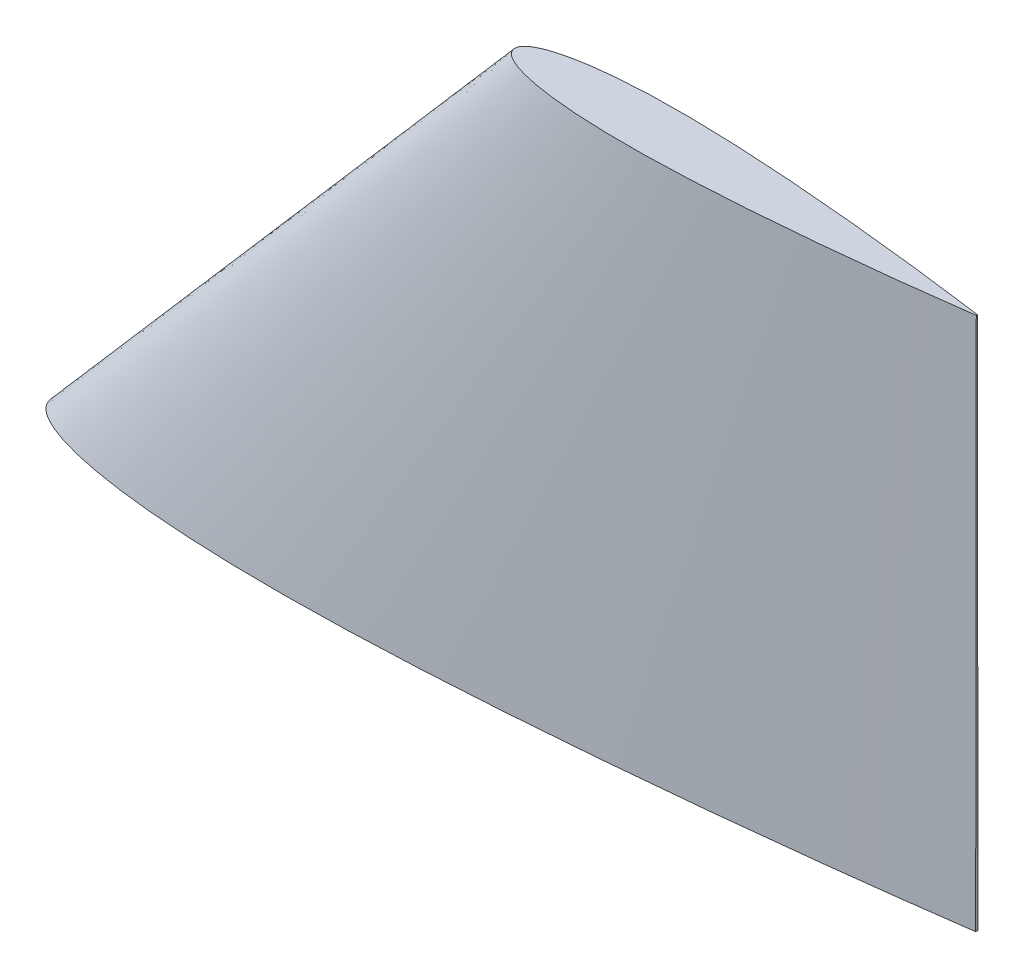
from build123d import *


with BuildPart() as part:
    # Sketch5 → Loft11 section 0
    with BuildSketch(Plane(origin=(0, 43.994090512, 0), x_dir=(1, 0, 0), z_dir=(0, 1, 0))):
        with BuildLine():
            Line((76.2, 0.048006), (76.2, -0.048006))
            add(Edge.make_bspline(
                [(76.2, -0.048006), (76.192583251, -0.049047765), (76.162942912, -0.053211081), (76.044647253, -0.069755857), (75.867562125, -0.094486743), (75.632052521, -0.126965392), (75.390396557, -0.160190201), (75.106127116, -0.198904989), (74.779917937, -0.242859006), (74.412541545, -0.291864294), (74.004851816, -0.345569023), (73.55779868, -0.403720926), (73.072416984, -0.465853222), (72.352060102, -0.55677244), (71.584541596, -0.651127112), (70.771637318, -0.748448048), (70.113353772, -0.825737809), (69.424771293, -0.904853153), (68.707537282, -0.985592031), (67.963304352, -1.067375261), (67.193834288, -1.14998319), (66.400894079, -1.232825488), (65.586352847, -1.315748636), (64.752102975, -1.398113207), (63.90010602, -1.479660513), (63.032340473, -1.559824173), (62.150830619, -1.638342101), (61.257640656, -1.714565201), (60.354852072, -1.788152536), (59.444584786, -1.858634165), (58.528953151, -1.925444296), (57.610108942, -1.988163902), (56.690197069, -2.046291991), (55.467880801, -2.116763144), (54.251069434, -2.176215597), (52.748712156, -2.234066929), (51.565971548, -2.266645454), (50.400091132, -2.283584551), (49.548035029, -2.288048273), (48.713726655, -2.284102235), (47.899118606, -2.271569022), (47.10611977, -2.250069868), (46.336564553, -2.21969991), (45.59224861, -2.180240934), (44.874904805, -2.131803537), (44.186222319, -2.074397819), (43.527802298, -2.008128116), (42.901174603, -1.933245819), (42.307783855, -1.850055304), (41.749027942, -1.758711647), (41.226187427, -1.659671366), (40.740465618, -1.55330687), (40.292997688, -1.439978722), (39.8847724, -1.320194614), (39.516689892, -1.194352348), (39.189535118, -1.062886557), (38.903955697, -0.926176493), (38.660495695, -0.784506781), (38.45943861, -0.638117579), (38.30117294, -0.486768084), (38.186080347, -0.330029549), (38.115712554, -0.167135854), (38.092341043, 0), (38.115712554, 0.167135854), (38.186080347, 0.330029549), (38.30117294, 0.486768084), (38.45943861, 0.638117579), (38.660495695, 0.784506781), (38.903955697, 0.926176493), (39.189535118, 1.062886557), (39.516689892, 1.194352348), (39.8847724, 1.320194614), (40.292997688, 1.439978722), (40.740465618, 1.55330687), (41.226187427, 1.659671366), (41.749027942, 1.758711647), (42.307783855, 1.850055304), (42.901174603, 1.933245819), (43.527802298, 2.008128116), (44.186222319, 2.074397819), (44.874904805, 2.131803537), (45.59224861, 2.180240934), (46.336564553, 2.21969991), (47.10611977, 2.250069868), (47.899118606, 2.271569022), (48.713726655, 2.284102235), (49.548035029, 2.288048273), (50.400091132, 2.283584551), (51.565971548, 2.266645454), (53.052575769, 2.225697023), (54.554732583, 2.162253193), (55.771346838, 2.09926718), (56.690197069, 2.046291991), (57.610108942, 1.988163902), (58.528953151, 1.925444296), (59.444584786, 1.858634165), (60.354852072, 1.788152536), (61.257640656, 1.714565201), (62.150830619, 1.638342101), (63.032340473, 1.559824173), (63.90010602, 1.479660513), (64.752102975, 1.398113207), (65.586352847, 1.315748636), (66.400894079, 1.232825488), (67.193834288, 1.14998319), (67.963304352, 1.067375261), (68.707537282, 0.985592031), (69.424771293, 0.904853153), (70.113353772, 0.825737809), (70.771637318, 0.748448048), (71.584541596, 0.651127112), (72.352060102, 0.55677244), (73.072416984, 0.465853222), (73.55779868, 0.403720926), (74.004851816, 0.345569023), (74.412541545, 0.291864294), (74.779917937, 0.242859006), (75.106127116, 0.198904989), (75.390396557, 0.160190201), (75.632052521, 0.126965392), (75.867562125, 0.094486743), (76.044647253, 0.069755857), (76.162942912, 0.053211081), (76.192583251, 0.049047765), (76.2, 0.048006)],
                knots=[0, 0, 0, 0, 0.000289201, 0.001155766, 0.004612322, 0.007193518, 0.010335793, 0.014031397, 0.018271612, 0.023045847, 0.028342901, 0.03415012, 0.04045376, 0.04723833, 0.062186613, 0.070313724, 0.078851908, 0.087780126, 0.097077521, 0.106722049, 0.116690868, 0.126960505, 0.137507218, 0.148306055, 0.159330765, 0.17055649, 0.181956531, 0.193504043, 0.205171367, 0.2169323, 0.228758169, 0.2406214, 0.252494936, 0.264350287, 0.287897994, 0.299535854, 0.322404759, 0.333584032, 0.344559266, 0.35530596, 0.365799778, 0.37601757, 0.3859373, 0.395537659, 0.404797976, 0.413698812, 0.422221441, 0.430349273, 0.438066019, 0.445356904, 0.452209372, 0.458611567, 0.464554044, 0.47002985, 0.475034902, 0.479569141, 0.483636857, 0.487250263, 0.490431338, 0.493218828, 0.495674086, 0.497891368, 0.5, 0.502108632, 0.504325914, 0.506781172, 0.509568662, 0.512749737, 0.516363143, 0.520430859, 0.524965098, 0.52997015, 0.535445956, 0.541388433, 0.547790628, 0.554643096, 0.561933981, 0.569650727, 0.577778559, 0.586301188, 0.595202024, 0.604462341, 0.6140627, 0.62398243, 0.634200222, 0.64469404, 0.655440734, 0.666415968, 0.677595241, 0.700464146, 0.723839427, 0.735649713, 0.747505064, 0.7593786, 0.771241831, 0.7830677, 0.794828633, 0.806495957, 0.818043469, 0.82944351, 0.840669235, 0.851693945, 0.862492782, 0.873039495, 0.883309132, 0.893277951, 0.902922479, 0.912219874, 0.921148092, 0.929686276, 0.937813387, 0.95276167, 0.95954624, 0.96584988, 0.971657099, 0.976954153, 0.981728388, 0.985968603, 0.989664207, 0.992806482, 0.995387678, 0.998844234, 0.999710799, 1, 1, 1, 1], degree=3))
        make_face()
    # Sketch3 → Loft11 section 1
    with BuildSketch(Plane(origin=(0, 0, 0), x_dir=(1, 0, 0), z_dir=(0, 1, 0))):
        with BuildLine():
            Line((76.2, 0.096012), (76.2, -0.096012))
            add(Edge.make_bspline(
                [(76.2, -0.096012), (76.185166502, -0.09809553), (76.125885823, -0.106422162), (75.889294507, -0.139511713), (75.53512425, -0.188973486), (75.064105041, -0.253930784), (74.580793115, -0.320380401), (74.012254232, -0.397809978), (73.359835874, -0.485718012), (72.62508309, -0.583728588), (71.809703632, -0.691138045), (70.915597359, -0.807441851), (69.944833968, -0.931706445), (68.504120203, -1.113544881), (66.969083191, -1.302254225), (65.343274636, -1.496896097), (64.026707544, -1.651475618), (62.649542587, -1.809706305), (61.215074564, -1.971184062), (59.726608705, -2.134750522), (58.187668577, -2.299966381), (56.601788159, -2.465650976), (54.972705694, -2.631497273), (53.30420595, -2.796226414), (51.60021204, -2.959321026), (49.864680946, -3.119648346), (48.101661238, -3.276684202), (46.315281313, -3.429130403), (44.509704144, -3.576305072), (42.689169571, -3.71726833), (40.857906302, -3.850888591), (39.020217884, -3.976327805), (37.180394137, -4.092583982), (34.735761601, -4.233526287), (32.302138868, -4.352431193), (29.297424312, -4.468133858), (26.931943095, -4.533290908), (24.600182263, -4.567169102), (22.896070057, -4.576096546), (21.22745331, -4.56820447), (19.598237213, -4.543138044), (18.01223954, -4.500139735), (16.473129105, -4.43939982), (14.98449722, -4.360481867), (13.549809609, -4.263607073), (12.172444638, -4.148795638), (10.855604596, -4.016256231), (9.602349205, -3.866491638), (8.41556771, -3.700110609), (7.298055884, -3.517423293), (6.252374854, -3.319342733), (5.280931237, -3.10661374), (4.385995376, -2.879957444), (3.569544801, -2.640389227), (2.833379783, -2.388704697), (2.179070236, -2.125773113), (1.607911394, -1.852352986), (1.120991389, -1.569013562), (0.71887722, -1.276235157), (0.40234588, -0.973536168), (0.172160694, -0.660059098), (0.031425108, -0.334271708), (-0.015317913, 0), (0.031425108, 0.334271708), (0.172160694, 0.660059098), (0.40234588, 0.973536168), (0.71887722, 1.276235157), (1.120991389, 1.569013562), (1.607911394, 1.852352986), (2.179070236, 2.125773113), (2.833379783, 2.388704697), (3.569544801, 2.640389227), (4.385995376, 2.879957444), (5.280931237, 3.10661374), (6.252374854, 3.319342733), (7.298055884, 3.517423293), (8.41556771, 3.700110609), (9.602349205, 3.866491638), (10.855604596, 4.016256231), (12.172444638, 4.148795638), (13.549809609, 4.263607073), (14.98449722, 4.360481867), (16.473129105, 4.43939982), (18.01223954, 4.500139735), (19.598237213, 4.543138044), (21.22745331, 4.56820447), (22.896070057, 4.576096546), (24.600182263, 4.567169102), (26.931943095, 4.533290908), (29.905151537, 4.451394045), (32.909465167, 4.324506385), (35.342693676, 4.198534359), (37.180394137, 4.092583982), (39.020217884, 3.976327805), (40.857906302, 3.850888591), (42.689169571, 3.71726833), (44.509704144, 3.576305072), (46.315281313, 3.429130403), (48.101661238, 3.276684202), (49.864680946, 3.119648346), (51.60021204, 2.959321026), (53.30420595, 2.796226414), (54.972705694, 2.631497273), (56.601788159, 2.465650976), (58.187668577, 2.299966381), (59.726608705, 2.134750522), (61.215074564, 1.971184062), (62.649542587, 1.809706305), (64.026707544, 1.651475618), (65.343274636, 1.496896097), (66.969083191, 1.302254225), (68.504120203, 1.113544881), (69.944833968, 0.931706445), (70.915597359, 0.807441851), (71.809703632, 0.691138045), (72.62508309, 0.583728588), (73.359835874, 0.485718012), (74.012254232, 0.397809978), (74.580793115, 0.320380401), (75.064105041, 0.253930784), (75.53512425, 0.188973486), (75.889294507, 0.139511713), (76.125885823, 0.106422162), (76.185166502, 0.09809553), (76.2, 0.096012)],
                knots=[0, 0, 0, 0, 0.000289201, 0.001155766, 0.004612322, 0.007193518, 0.010335793, 0.014031397, 0.018271612, 0.023045847, 0.028342901, 0.03415012, 0.04045376, 0.04723833, 0.062186613, 0.070313724, 0.078851908, 0.087780126, 0.097077521, 0.106722049, 0.116690868, 0.126960505, 0.137507218, 0.148306055, 0.159330765, 0.17055649, 0.181956531, 0.193504043, 0.205171367, 0.2169323, 0.228758169, 0.2406214, 0.252494936, 0.264350287, 0.287897994, 0.299535854, 0.322404759, 0.333584032, 0.344559266, 0.35530596, 0.365799778, 0.37601757, 0.3859373, 0.395537659, 0.404797976, 0.413698812, 0.422221441, 0.430349273, 0.438066019, 0.445356904, 0.452209372, 0.458611567, 0.464554044, 0.47002985, 0.475034902, 0.479569141, 0.483636857, 0.487250263, 0.490431338, 0.493218828, 0.495674086, 0.497891368, 0.5, 0.502108632, 0.504325914, 0.506781172, 0.509568662, 0.512749737, 0.516363143, 0.520430859, 0.524965098, 0.52997015, 0.535445956, 0.541388433, 0.547790628, 0.554643096, 0.561933981, 0.569650727, 0.577778559, 0.586301188, 0.595202024, 0.604462341, 0.6140627, 0.62398243, 0.634200222, 0.64469404, 0.655440734, 0.666415968, 0.677595241, 0.700464146, 0.723839427, 0.735649713, 0.747505064, 0.7593786, 0.771241831, 0.7830677, 0.794828633, 0.806495957, 0.818043469, 0.82944351, 0.840669235, 0.851693945, 0.862492782, 0.873039495, 0.883309132, 0.893277951, 0.902922479, 0.912219874, 0.921148092, 0.929686276, 0.937813387, 0.95276167, 0.95954624, 0.96584988, 0.971657099, 0.976954153, 0.981728388, 0.985968603, 0.989664207, 0.992806482, 0.995387678, 0.998844234, 0.999710799, 1, 1, 1, 1], degree=3))
        make_face()
    loft()

    # Sketch8 → Cut-Revolve1 (revolve, cut)
    with BuildSketch(Plane.XY, mode=Mode.PRIVATE) as cut_revolve1_sk:
        Polygon((20.955, 0), (20.955, 12.7), (19.05, 15.999556788), (19.05, 0), align=None)
    cut_revolve1 = revolve(cut_revolve1_sk.sketch.rotate(Axis((19.05, 15.999556788, 0), (0, -1, 0)), 180), axis=Axis((19.05, 15.999556788, 0), (0, -1, 0)), mode=Mode.SUBTRACT)

    # Mirror1: Cut-Revolve1 across plane
    add(cut_revolve1.mirror(Plane(origin=(22.225, 0, 0), x_dir=(0, 0, 1), z_dir=(1, 0, 0))), mode=Mode.SUBTRACT)

    # Mirror2: Cut-Revolve1 across plane
    add(cut_revolve1.mirror(Plane(origin=(28.575, 0, 0), x_dir=(0, 0, 1), z_dir=(1, 0, 0))), mode=Mode.SUBTRACT)

    # Mirror2 copy 1 sketch → Mirror2 copy 1 (revolve, cut)
    with BuildSketch(Plane(origin=(12.7, 0, 0), x_dir=(1, 0, 0), z_dir=(0, 0, 1))):
        Polygon((20.955, 0), (20.955, 12.7), (19.05, 15.999556788), (19.05, 0), align=None)
    revolve(axis=Axis((31.75, 15.999556788, 0), (0, -1, 0)), mode=Mode.SUBTRACT)


solid = part.part
